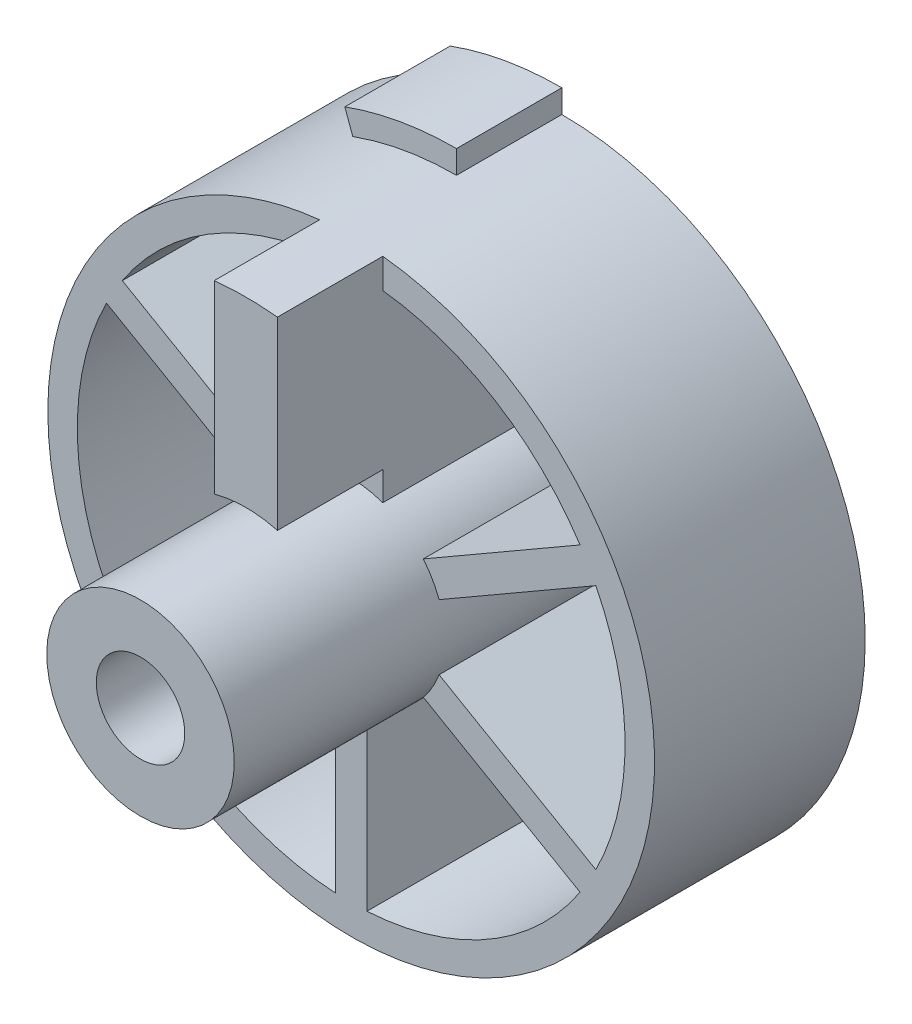
from build123d import *
from build123d.topology import SkipClean

# Parameters (mm, degrees)
SKETCH_1_R          = 4.2
EXTRUDE_1_DEPTH     = 10
SKETCH_2_R          = 28.8
EXTRUDE_2_DEPTH     = 10
SKETCH_3_R          = 8.9
EXTRUDE_3_DEPTH     = 20
SKETCH_4_R          = 4.2
CUT_EXTRUDE_1_DEPTH = 59.227484919
CUT_EXTRUDE_2_DEPTH = 47.802136703
SKETCH_8_W          = 6
SKETCH_8_H          = 20.041446809
EXTRUDE_4_DEPTH     = 20
EXTRUDE_5_DEPTH     = 10


with BuildPart() as part:
    # 草图1 → 凸台-拉伸1 (new body)
    with BuildSketch(Plane.XY):
        with BuildLine():
            Line((0, 31), (0, 28.8))
            ThreePointArc((0, 28.8), (28.362463287, 5.001067517), (9.850180128, -27.063147479))
            Line((9.850180128, -27.063147479), (10.602624443, -29.130471244))
            ThreePointArc((10.602624443, -29.130471244), (5.383093508, -30.529040343), (0, -31))
            Line((0, -31), (0, -28.8))
            ThreePointArc((0, -28.8), (-28.362463287, -5.001067517), (-9.850180128, 27.063147479))
            Line((-9.850180128, 27.063147479), (-10.602624443, 29.130471244))
            ThreePointArc((-10.602624443, 29.130471244), (-5.383093508, 30.529040343), (0, 31))
        make_face()
        Circle(SKETCH_1_R, mode=Mode.SUBTRACT)
    extrude(amount=EXTRUDE_1_DEPTH)

    # 草图2 → 凸台-拉伸2 (add)
    with BuildSketch(Plane.XY.offset(10)):
        with Locations(Location((0, 0, 0), (0, 0, 110))):
            Circle(SKETCH_2_R)
    extrude(amount=EXTRUDE_2_DEPTH)

    # 草图3 → 凸台-拉伸3 (add)
    with BuildSketch(Plane.XY.offset(20)):
        Circle(SKETCH_3_R)
    extrude(amount=EXTRUDE_3_DEPTH)

    # 草图4 → 切除-拉伸1 (cut, through all)
    with BuildSketch(Plane.XY.offset(40)):
        Circle(SKETCH_4_R)
    extrude(amount=-CUT_EXTRUDE_1_DEPTH, mode=Mode.SUBTRACT)

    # 草图5 → 切除-拉伸2 (cut, through all)
    with BuildSketch(Plane.XY.offset(20)):
        with BuildLine():
            Line((21.729157013, 14.277385458), (6.847367965, 5.685380546))
            ThreePointArc((6.847367965, 5.685380546), (4.45, 7.707626094), (1.5, 8.77268488))
            Line((1.5, 8.77268488), (1.5, 25.956694705))
            ThreePointArc((1.5, 25.956694705), (13, 22.516660498), (21.729157013, 14.277385458))
        make_face()
        with BuildLine():
            Line((-1.5, 25.956694705), (-1.5, 8.77268488))
            ThreePointArc((-1.5, 8.77268488), (-4.45, 7.707626094), (-6.847367965, 5.685380546))
            Line((-6.847367965, 5.685380546), (-21.729157013, 14.277385458))
            ThreePointArc((-21.729157013, 14.277385458), (-13, 22.516660498), (-1.5, 25.956694705))
        make_face()
        with BuildLine():
            Line((23.229157013, 11.679309247), (8.347367965, 3.087304334))
            ThreePointArc((8.347367965, 3.087304334), (8.9, 0), (8.347367965, -3.087304334))
            Line((8.347367965, -3.087304334), (23.229157013, -11.679309247))
            ThreePointArc((23.229157013, -11.679309247), (26, 0), (23.229157013, 11.679309247))
        make_face()
        with BuildLine():
            Line((21.729157013, -14.277385458), (6.847367965, -5.685380546))
            ThreePointArc((6.847367965, -5.685380546), (4.45, -7.707626094), (1.5, -8.77268488))
            Line((1.5, -8.77268488), (1.5, -25.956694705))
            ThreePointArc((1.5, -25.956694705), (13, -22.516660498), (21.729157013, -14.277385458))
        make_face()
        with BuildLine():
            Line((-1.5, -25.956694705), (-1.5, -8.77268488))
            ThreePointArc((-1.5, -8.77268488), (-4.45, -7.707626094), (-6.847367965, -5.685380546))
            Line((-6.847367965, -5.685380546), (-21.729157013, -14.277385458))
            ThreePointArc((-21.729157013, -14.277385458), (-13, -22.516660498), (-1.5, -25.956694705))
        make_face()
        with BuildLine():
            Line((-23.229157013, -11.679309247), (-8.347367965, -3.087304334))
            ThreePointArc((-8.347367965, -3.087304334), (-8.9, 0), (-8.347367965, 3.087304334))
            Line((-8.347367965, 3.087304334), (-23.229157013, 11.679309247))
            ThreePointArc((-23.229157013, 11.679309247), (-26, 0), (-23.229157013, -11.679309247))
        make_face()
    extrude(amount=-CUT_EXTRUDE_2_DEPTH, mode=Mode.SUBTRACT)

    # 草图8 → 凸台-拉伸4 (add)
    with BuildSketch(Plane.XY.offset(20)):
        with Locations((0, 17.104380285)):
            Rectangle(SKETCH_8_W, SKETCH_8_H)
    extrude(amount=-EXTRUDE_4_DEPTH)

    # 草图9 → 凸台-拉伸5 (add)
    with SkipClean():  # the faces are left unmerged after this step: merging them gives an invalid solid
        with BuildSketch(Plane.XY.offset(20)):
            with BuildLine():
                Line((-3, 28.643323829), (-3, 11.101801656))
                ThreePointArc((-3, 11.101801656), (0, 11.5), (3, 11.101801656))
                Line((3, 11.101801656), (3, 28.643323829))
                ThreePointArc((3, 28.643323829), (0, 28.8), (-3, 28.643323829))
            make_face()
        extrude(amount=EXTRUDE_5_DEPTH)


solid = part.part
